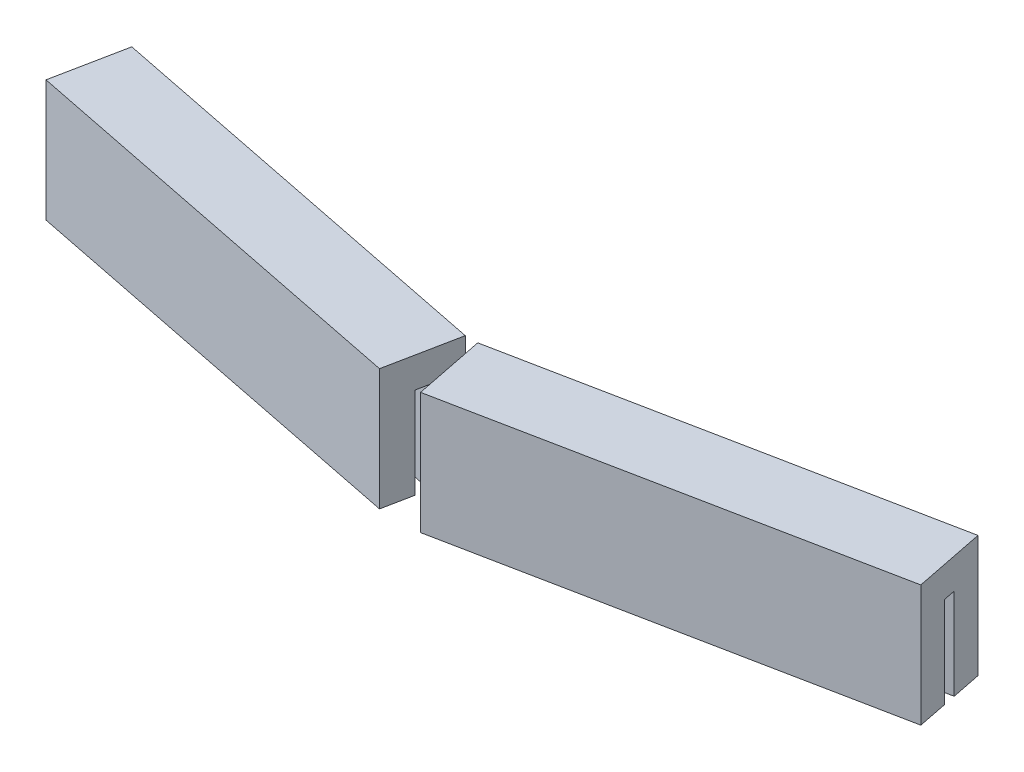
from build123d import *

# Parameters (mm, degrees)
BOSS_EXTRUDE1_DEPTH   = 5
BOSS_EXTRUDE1_2_DEPTH = 5
BOSS_EXTRUDE2_DEPTH   = 20


with BuildPart() as part:
    # Sketch1 → Boss-Extrude1 (new body)
    with BuildSketch(Plane(origin=(0, 0, 0), x_dir=(1, 0, 0), z_dir=(0, 1, 0))):
        Polygon((27.17022743, -94.819563398), (27.5624597, -96.780724749), (96.203106998, -83.05259529), (95.810874728, -81.091433938), align=None)
    extrude(amount=BOSS_EXTRUDE1_DEPTH)



with BuildPart() as body_2:
    # Sketch1 → Boss-Extrude1 2 (new body)
    with BuildSketch(Plane(origin=(0, 0, 0), x_dir=(1, 0, 0), z_dir=(0, 1, 0))):
        Polygon((22.766076999, -96.780724749), (23.15830927, -94.819563398), (-45.482338029, -81.091433938), (-45.874570299, -83.05259529), align=None)
    extrude(amount=BOSS_EXTRUDE1_2_DEPTH)


with BuildPart() as part_1:
    add(part.part)

    add(body_2.part)  # Boss-Extrude2 merges body 2
    # Sketch2 → Boss-Extrude2 (add)
    with BuildSketch(Plane(origin=(0, 5, 0), x_dir=(1, 0, 0), z_dir=(0, 1, 0))):
        Polygon((-45.482338029, -81.091433938), (-44.501757353, -76.18853056), (24.138889945, -89.916660019), (23.15830927, -94.819563398), align=None)
        Polygon((21.785496324, -101.683628128), (22.766076999, -96.780724749), (-45.874570299, -83.05259529), (-46.855150975, -87.955498668), align=None)
        Polygon((27.17022743, -94.819563398), (26.189646754, -89.916660019), (94.830294052, -76.18853056), (95.810874728, -81.091433938), align=None)
        Polygon((97.183687674, -87.955498668), (96.203106998, -83.05259529), (27.5624597, -96.780724749), (28.543040376, -101.683628128), align=None)
    extrude(amount=-BOSS_EXTRUDE2_DEPTH)


solid = part_1.part
